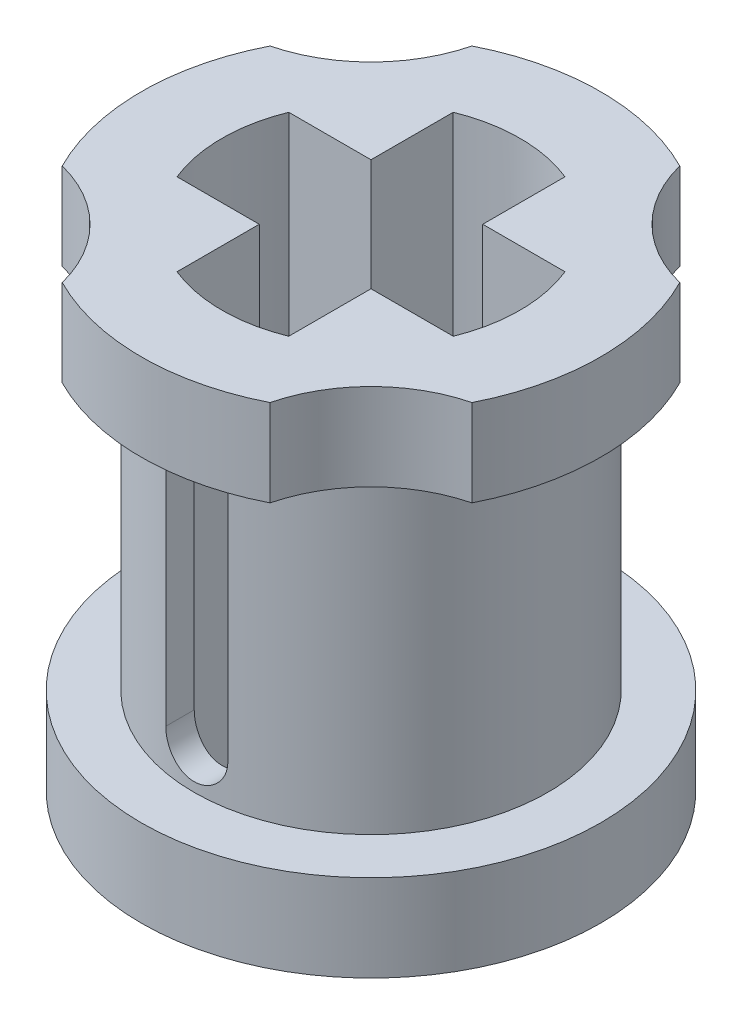
from build123d import *

# Parameters (mm, degrees)
SKETCH1_R           = 2.85
MIDDLE_BODY_DEPTH   = 2.55
SKETCH2_R           = 3.7
OUTER_RIM_DEPTH     = 1.4
AXLE_CUT_DEPTH      = 7.556104026
AXLE_CUT_DEPTH_BACK = 7.556104026
SKETCH3_W           = 1.8
SKETCH3_H           = 1.8
SLOT_CUT_DEPTH      = 7.556104026
SLOT_CUT_DEPTH_BACK = 7.556104026
SKETCH5_R           = 2.24600999
SCALLOP_CUT_DEPTH   = 1.4


with BuildPart() as part:
    # Sketch1 → Middle Body (new, symmetric)
    with BuildSketch(Plane(origin=(0, 0, 0), x_dir=(1, 0, 0), z_dir=(0, 1, 0))):
        with Locations(Location((0, 0, 0), (0, 0, 270))):
            Circle(SKETCH1_R)
    extrude(amount=MIDDLE_BODY_DEPTH, both=True)

    # Sketch2 → Outer Rim (add)
    with BuildSketch(Plane.XZ.offset(2.55)):
        with Locations(Location((0, 0, 0), (0, 0, 270))):
            Circle(SKETCH2_R)
    outer_rim = extrude(amount=OUTER_RIM_DEPTH)

    # Mirror1: Outer Rim across plane
    add(outer_rim.mirror(Plane.ZX))

    # Sketch3 → Axle Cut (cut, two sides: drawn at the far end of the back side and taken through both)
    with BuildSketch(Plane(origin=(0, 0, 0), x_dir=(1, 0, 0), z_dir=(0, 1, 0)).offset(-AXLE_CUT_DEPTH_BACK)):
        with BuildLine():
            Line((-0.9, 0.9), (0.9, 0.9))
            Line((0.9, 0.9), (0.9, 2.224859546))
            ThreePointArc((0.9, 2.224859546), (0.45844143, 2.355808026), (0, 2.4))
            ThreePointArc((0, 2.4), (-0.45844143, 2.355808026), (-0.9, 2.224859546))
            Line((-0.9, 2.224859546), (-0.9, 0.9))
        make_face()
        with BuildLine():
            Line((-2.224859546, -0.9), (-0.9, -0.9))
            Line((-0.9, -0.9), (-0.9, 0.9))
            Line((-0.9, 0.9), (-2.224859546, 0.9))
            ThreePointArc((-2.224859546, 0.9), (-2.355808026, 0.45844143), (-2.4, 0))
            ThreePointArc((-2.4, 0), (-2.355808026, -0.45844143), (-2.224859546, -0.9))
        make_face()
        Rectangle(SKETCH3_W, SKETCH3_H)
        with BuildLine():
            Line((0.9, -2.224859546), (0.9, -0.9))
            Line((0.9, -0.9), (-0.9, -0.9))
            Line((-0.9, -0.9), (-0.9, -2.224859546))
            ThreePointArc((-0.9, -2.224859546), (-0.45844143, -2.355808026), (0, -2.4))
            ThreePointArc((0, -2.4), (0.45844143, -2.355808026), (0.9, -2.224859546))
        make_face()
        with BuildLine():
            Line((0.9, -0.9), (2.224859546, -0.9))
            ThreePointArc((2.224859546, -0.9), (2.355808026, -0.45844143), (2.4, 0))
            ThreePointArc((2.4, 0), (2.355808026, 0.45844143), (2.224859546, 0.9))
            Line((2.224859546, 0.9), (0.9, 0.9))
            Line((0.9, 0.9), (0.9, -0.9))
        make_face()
    extrude(amount=AXLE_CUT_DEPTH + AXLE_CUT_DEPTH_BACK, mode=Mode.SUBTRACT)

    # Sketch4 → Slot Cut (cut, two sides: drawn at the far end of the back side and taken through both)
    with BuildSketch(Plane.XY.offset(-SLOT_CUT_DEPTH_BACK)):
        with BuildLine():
            Line((-0.5, -1.9), (-0.5, 1.9))
            ThreePointArc((-0.5, 1.9), (0, 2.4), (0.5, 1.9))
            Line((0.5, 1.9), (0.5, -1.9))
            ThreePointArc((0.5, -1.9), (0, -2.4), (-0.5, -1.9))
        make_face()
    extrude(amount=SLOT_CUT_DEPTH + SLOT_CUT_DEPTH_BACK, mode=Mode.SUBTRACT)

    # Sketch5 → Scallop Cut (cut)
    with BuildSketch(Plane(origin=(0, 3.95, 0), x_dir=(1, 0, 0), z_dir=(0, 1, 0))):
        with Locations((3.850910595, 3.850910595)):
            Circle(SKETCH5_R)
        with Locations((3.850910595, -3.850910595)):
            Circle(SKETCH5_R)
        with Locations((-3.850910595, -3.850910595)):
            Circle(SKETCH5_R)
        with Locations((-3.850910595, 3.850910595)):
            Circle(SKETCH5_R)
    extrude(amount=-SCALLOP_CUT_DEPTH, mode=Mode.SUBTRACT)


solid = part.part
